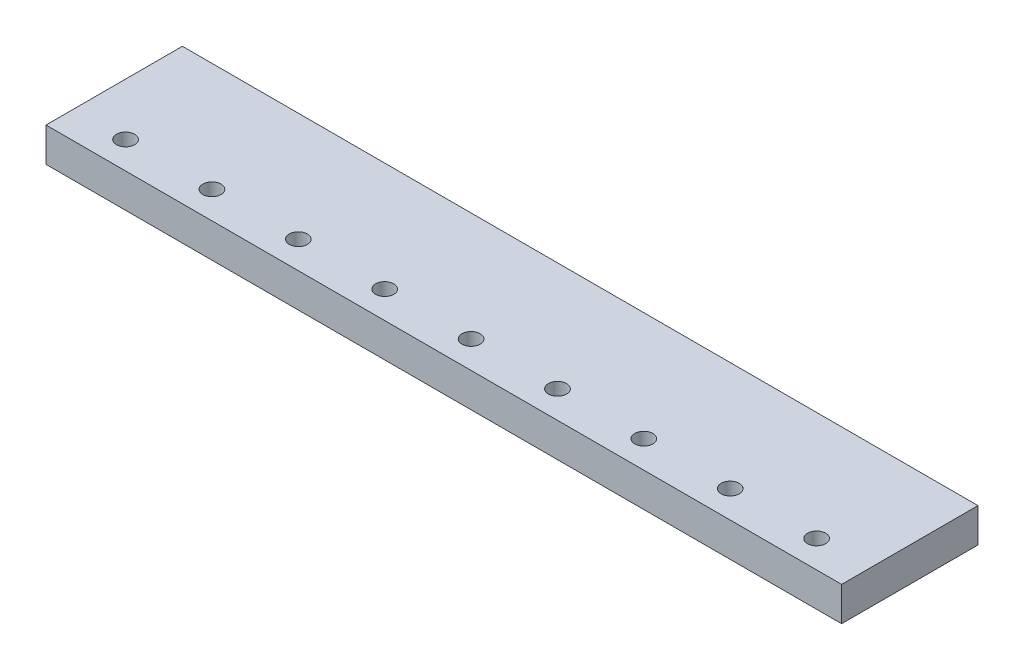
from build123d import *

# Parameters (mm, degrees)
SKETCH1_W           = 350
SKETCH1_H           = 60
BOSS_EXTRUDE1_DEPTH = 15
SKETCH2_R           = 4
CUT_EXTRUDE1_DEPTH  = 356.422284051


with BuildPart() as part:
    # Sketch1 → Boss-Extrude1 (new body)
    with BuildSketch(Plane(origin=(0, 0, 0), x_dir=(1, 0, 0), z_dir=(0, 1, 0))):
        with Locations((175, -30)):
            Rectangle(SKETCH1_W, SKETCH1_H)
    extrude(amount=BOSS_EXTRUDE1_DEPTH)

    # Sketch2 → Cut-Extrude1 (cut, through all)
    with BuildSketch(Plane(origin=(0, 15, 0), x_dir=(1, 0, 0), z_dir=(0, 1, 0))):
        with Locations(Location((23, -48, 0), (0, 0, 270))):
            Circle(SKETCH2_R)
        with Locations(Location((61, -48, 0), (0, 0, 270))):
            Circle(SKETCH2_R)
        with Locations(Location((99, -48, 0), (0, 0, 270))):
            Circle(SKETCH2_R)
        with Locations(Location((137, -48, 0), (0, 0, 270))):
            Circle(SKETCH2_R)
        with Locations(Location((175, -48, 0), (0, 0, 270))):
            Circle(SKETCH2_R)
        with Locations(Location((213, -48, 0), (0, 0, 270))):
            Circle(SKETCH2_R)
        with Locations(Location((251, -48, 0), (0, 0, 270))):
            Circle(SKETCH2_R)
        with Locations(Location((289, -48, 0), (0, 0, 270))):
            Circle(SKETCH2_R)
        with Locations(Location((327, -48, 0), (0, 0, 270))):
            Circle(SKETCH2_R)
    extrude(amount=-CUT_EXTRUDE1_DEPTH, mode=Mode.SUBTRACT)


solid = part.part
